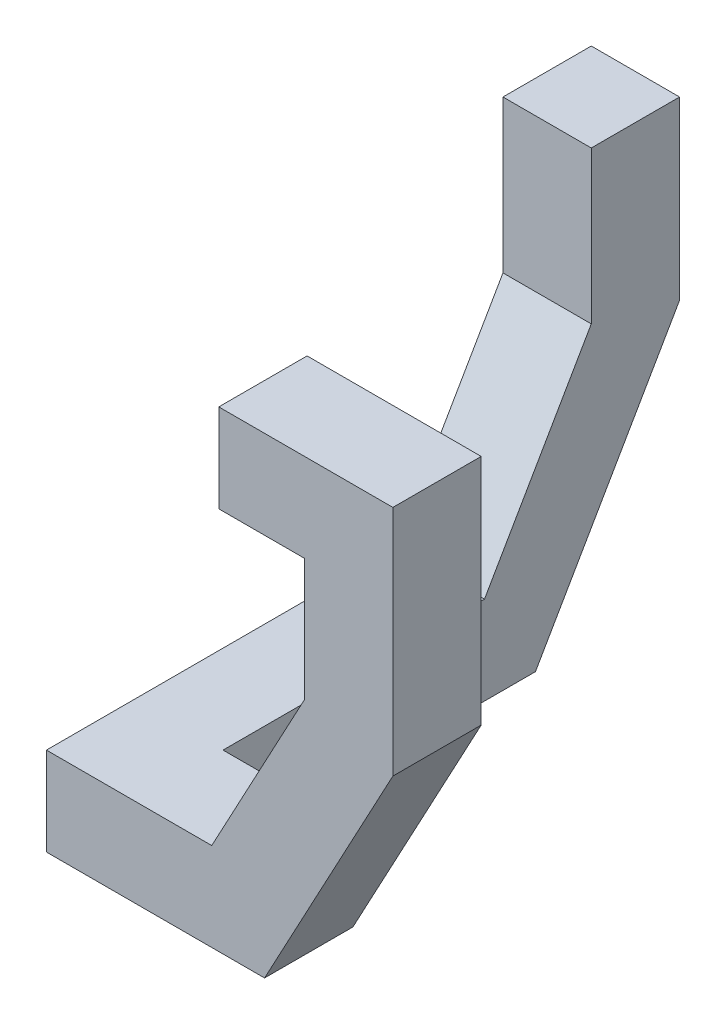
from build123d import *

# Parameters (mm, degrees)
BOSS_EXTRUDE1_DEPTH      = 2.5
BOSS_EXTRUDE1_DEPTH_BACK = 2.5
BOSS_EXTRUDE2_DEPTH      = 5


with BuildPart() as part:
    # Sketch1 → Boss-Extrude1 (new, two sides: drawn at the far end of the back side and taken through both)
    with BuildSketch(Plane(origin=(0, 0, 0), x_dir=(0, 0, -1), z_dir=(1, 0, 0)).offset(-BOSS_EXTRUDE1_DEPTH_BACK)):
        Polygon((-5, 2.397355183), (0, 2.397355183), (0, -7.568357101), (-8.160177325, -21.702198826), (-25.849658622, -21.702198826), (-25.849658622, -16.702198826), (-11.046928671, -16.702198826), (-5, -6.228611139), align=None)
    extrude(amount=BOSS_EXTRUDE1_DEPTH + BOSS_EXTRUDE1_DEPTH_BACK)

    # Sketch2 → Boss-Extrude2 (add)
    with BuildSketch(Plane.XY.offset(25.849658622)):
        Polygon((5, -16.702198826), (6.860371394, -16.702198826), (12.116424273, -6.911667965), (12.116424273, 0.006104054), (7.259579322, 0.006104054), (7.259579322, 5.006104054), (17.116424273, 5.006104054), (17.116424273, -8.168933695), (9.851082059, -21.702198826), (5, -21.702198826), (-2.5, -21.702198826), (-2.5, -16.702198826), align=None)
    extrude(amount=BOSS_EXTRUDE2_DEPTH)


solid = part.part
